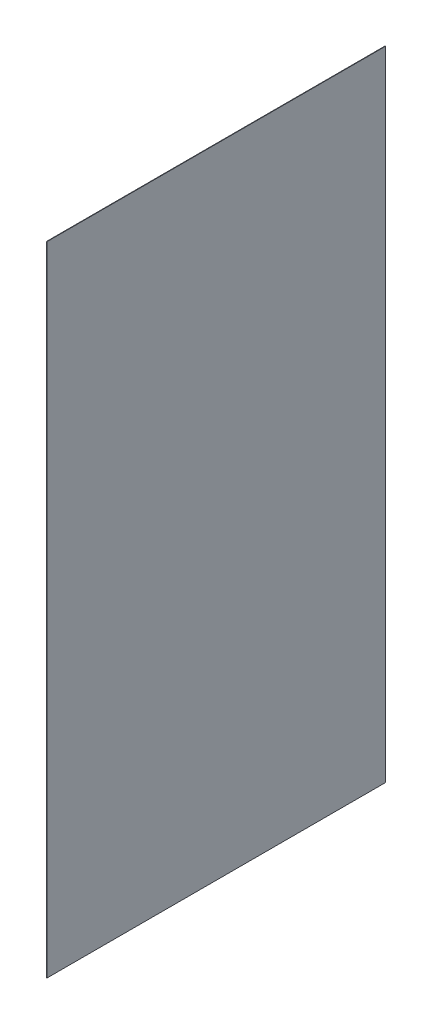
from build123d import *

# Parameters (mm, degrees)
SKETCH1_W                        = 1
SKETCH1_H                        = 1427.5
STORE_ORTA_BOLME_SAC_SAG_1_DEPTH = 757.5


with BuildPart() as part:
    # Sketch1 → STORE_orta_bolme_sac_sag_1 (new body)
    with BuildSketch(Plane.XY):
        with Locations((713.5, 896.25)):
            Rectangle(SKETCH1_W, SKETCH1_H)
    extrude(amount=-STORE_ORTA_BOLME_SAC_SAG_1_DEPTH)


solid = part.part
